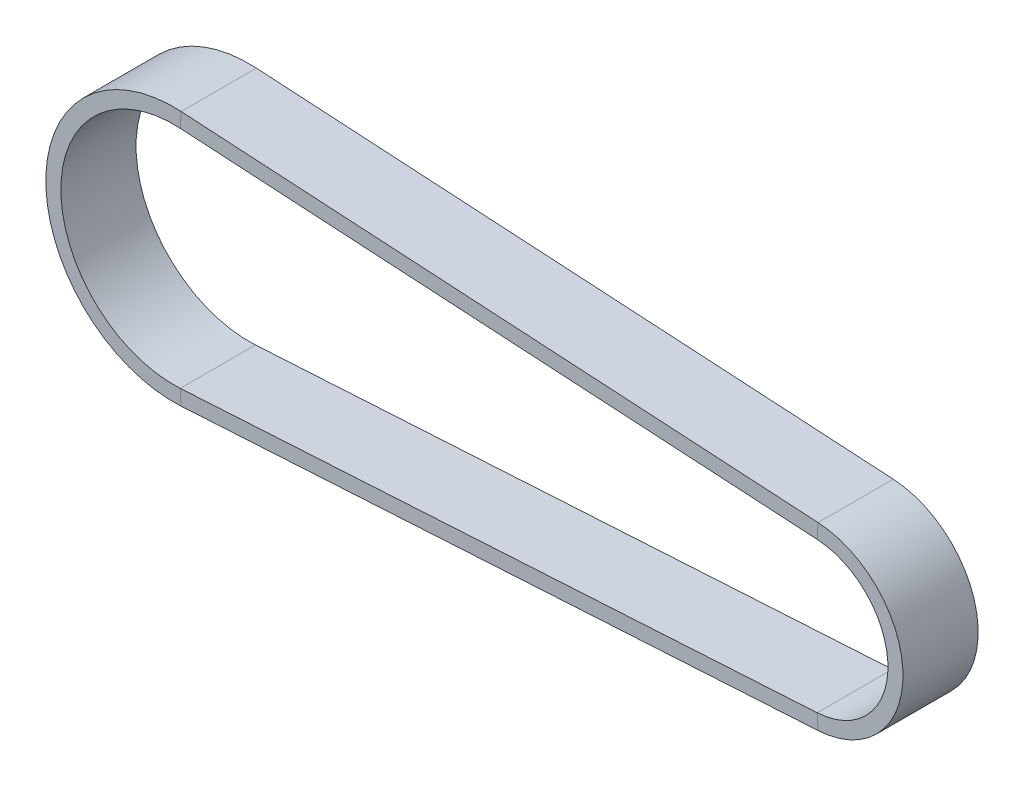
from build123d import *

# Parameters (mm, degrees)
SKIZZE2_W = 2
SKIZZE2_H = 10


with BuildPart() as part:
    # Austragung1: sweep along a path in Skizze3
    with BuildLine(Plane.XY.offset(15.5)) as austragung1_path:
        ThreePointArc((-15, 0), (-10.289915109, 10.914103127), (0.882352941, 14.974025955))
        Line((0.882352941, 14.974025955), (85.588235294, 9.98268397))
        ThreePointArc((85.588235294, 9.98268397), (92.276068751, 6.859943406), (95, 0))
    # Skizze2 → Austragung1 (sweep)
    with BuildSketch(Plane(origin=(0, 0, 0), x_dir=(1, 0, 0), z_dir=(0, 1, 0))):
        with Locations((-16, -15.5)):
            Rectangle(SKIZZE2_W, SKIZZE2_H)
    sweep(path=austragung1_path.line)

    # Spiegeln1: part across plane


with BuildPart() as part_1:
    add(part.part)
    add(part.part.mirror(Plane(origin=(0, 0, 0), x_dir=(0, 0, 1), z_dir=(0, -1, 0))))


solid = part_1.part
